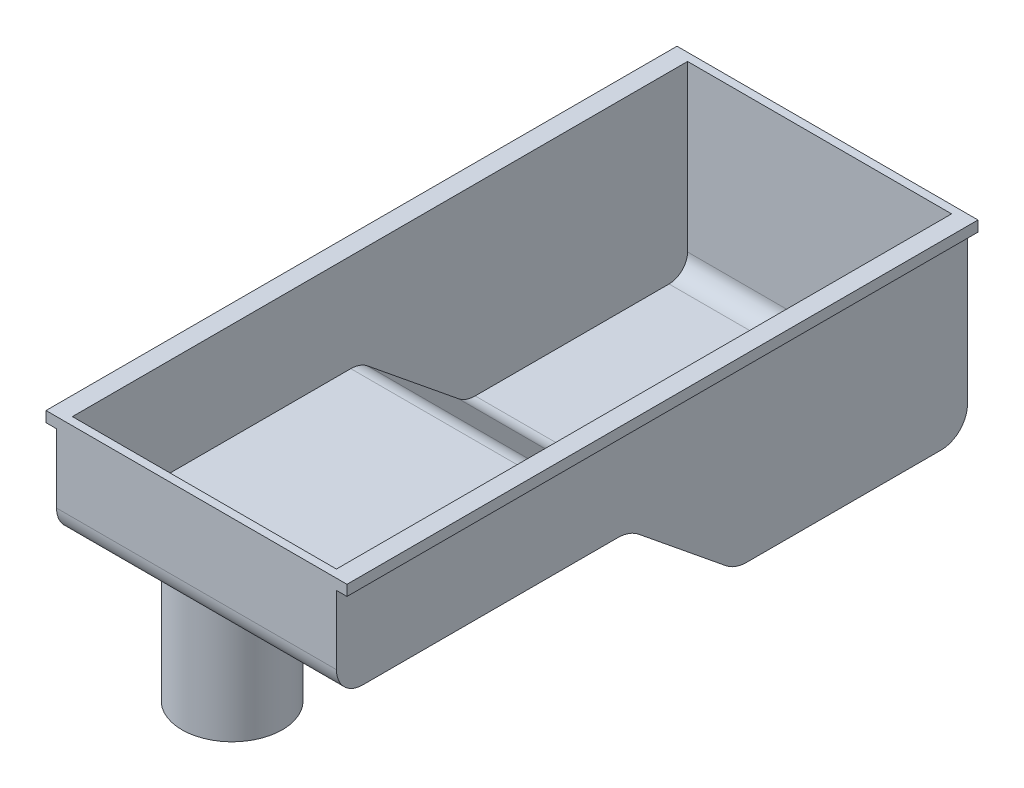
from build123d import *

# Parameters (mm, degrees)
PAN_START            = -106
PAN_BODY_DEPTH       = 212
PAN_START_2          = -406
SKETCH2_W            = 228
SKETCH2_H            = 8
PAN_RAIL_DEPTH       = 478
SUMP_START           = -100
SUMP_DEPTH           = 200
DRAIN_START          = -225
SKETCH4_R            = 11
DRAIN_PLUG_DEPTH     = 11
FILTER_START         = -160
SKETCH5_R            = 42
FILTER_ADAPTER_DEPTH = 11
OIL_START            = -262
SKETCH6_R            = 38
OIL_FILTER_DEPTH     = 102


with BuildPart() as part:
    # Sketch1 → Pan Body (new body)
    with BuildSketch(Plane(origin=(0, 0, 0), x_dir=(0, 0, -1), z_dir=(1, 0, 0)).offset(PAN_START)):
        with BuildLine():
            Line((-72, -70), (406, -70))
            Line((406, -70), (406, -195))
            ThreePointArc((406, -195), (400.142135624, -209.142135624), (386, -215))
            Line((386, -215), (238.876015631, -215))
            ThreePointArc((238.876015631, -215), (230.51154464, -213.559194066), (223.111200004, -209.402850003))
            Line((223.111200004, -209.402850003), (156.888799996, -155.597149997))
            ThreePointArc((156.888799996, -155.597149997), (149.48845536, -151.440805934), (141.123984369, -150))
            Line((141.123984369, -150), (-52, -150))
            ThreePointArc((-52, -150), (-66.142135624, -144.142135624), (-72, -130))
            Line((-72, -130), (-72, -70))
        make_face()
    extrude(amount=PAN_BODY_DEPTH)

    # Sketch2 → Pan Rail (add)
    with BuildSketch(Plane.XY.offset(PAN_START_2)):
        with Locations((0, -74)):
            Rectangle(SKETCH2_W, SKETCH2_H)
    extrude(amount=PAN_RAIL_DEPTH)

    # Sketch3 → Sump (cut)
    with BuildSketch(Plane(origin=(0, 0, 0), x_dir=(0, 0, -1), z_dir=(1, 0, 0)).offset(SUMP_START)):
        with BuildLine():
            Line((-66, -60), (400, -60))
            Line((400, -60), (400, -195))
            ThreePointArc((400, -195), (395.899494937, -204.899494937), (386, -209))
            Line((386, -209), (239.100812505, -209))
            ThreePointArc((239.100812505, -209), (232.409235712, -207.847355253), (226.488960003, -204.522280002))
            Line((226.488960003, -204.522280002), (157.511039997, -148.477719998))
            ThreePointArc((157.511039997, -148.477719998), (151.590764288, -145.152644747), (144.899187495, -144))
            Line((144.899187495, -144), (-52, -144))
            ThreePointArc((-52, -144), (-61.899494937, -139.899494937), (-66, -130))
            Line((-66, -130), (-66, -60))
        make_face()
    extrude(amount=SUMP_DEPTH, mode=Mode.SUBTRACT)

    # Sketch4 → Drain Plug (add)
    with BuildSketch(Plane(origin=(0, 0, 0), x_dir=(1, 0, 0), z_dir=(0, 1, 0)).offset(DRAIN_START)):
        with Locations(Location((0, 380, 0), (0, 0, 146.944268849))):
            Circle(SKETCH4_R)
    extrude(amount=DRAIN_PLUG_DEPTH)

    # Sketch5 → Filter Adapter (add)
    with BuildSketch(Plane(origin=(0, 0, 0), x_dir=(1, 0, 0), z_dir=(0, 1, 0)).offset(FILTER_START)):
        with Locations(Location((-45, 0, 0), (0, 0, 270))):
            Circle(SKETCH5_R)
    extrude(amount=FILTER_ADAPTER_DEPTH)

    # Sketch6 → Oil Filter (add)
    with BuildSketch(Plane(origin=(0, 0, 0), x_dir=(1, 0, 0), z_dir=(0, 1, 0)).offset(OIL_START)):
        with Locations(Location((-45, 0, 0), (0, 0, 270))):
            Circle(SKETCH6_R)
    extrude(amount=OIL_FILTER_DEPTH)


solid = part.part
